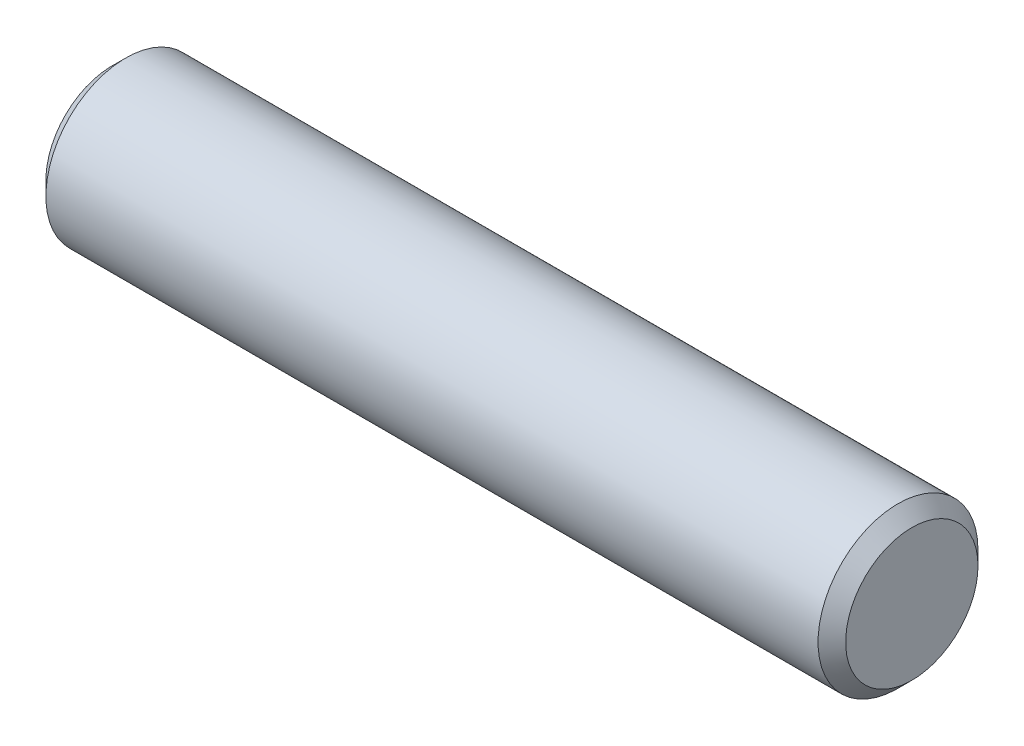
from build123d import *

# Parameters (mm, degrees)
BODYSKE_W     = 40
BODYSKE_H     = 4
CHAMFER1_SIZE = 0.6905


with BuildPart() as part:
    # BodySke → BaseBody (revolve)
    with BuildSketch(Plane.XY, mode=Mode.PRIVATE) as basebody_sk:
        with Locations((20, 2)):
            Rectangle(BODYSKE_W, BODYSKE_H)
    revolve(basebody_sk.sketch.rotate(Axis((-3.175, 0, 0), (1, 0, 0)), 90), axis=Axis((-3.175, 0, 0), (1, 0, 0)))

    # Chamfer1
    chamfer1_edges = [part.edges().sort_by_distance(p)[0] for p in [
        (0, 0, -4),
        (40, 0, -4),
    ]]
    chamfer(chamfer1_edges, length=CHAMFER1_SIZE)


solid = part.part
